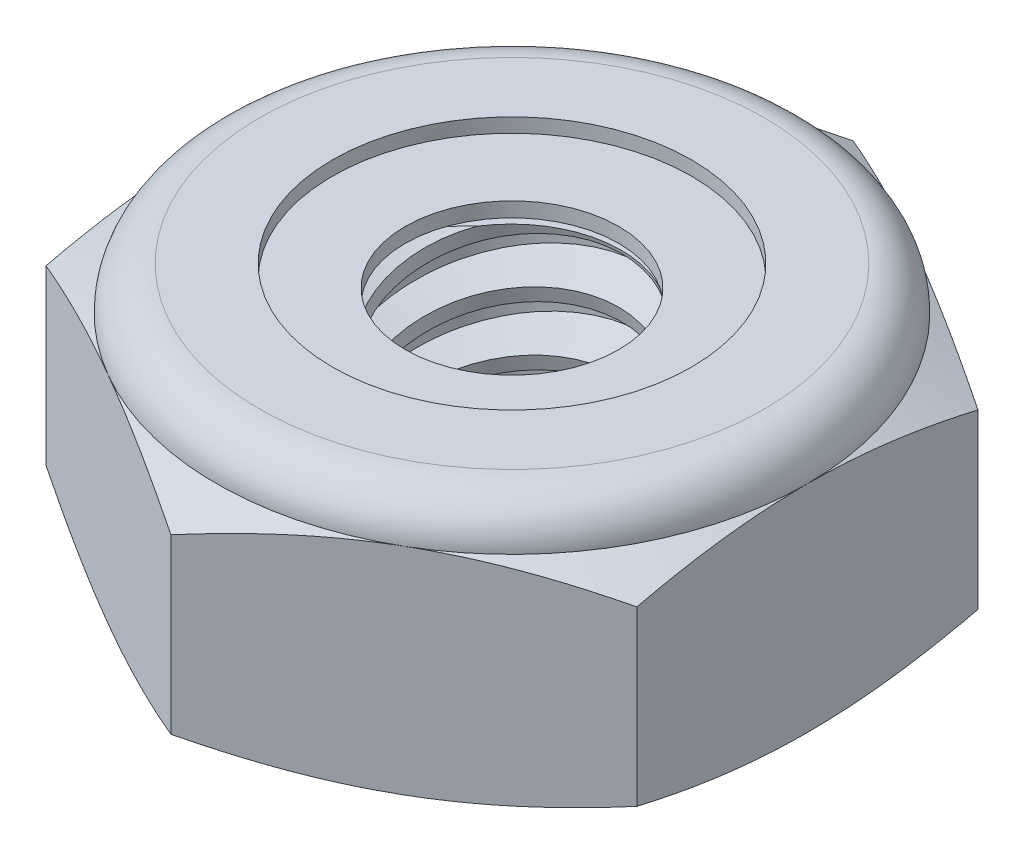
from build123d import *

# Parameters (mm, degrees)
EXTRUDE1_DEPTH      = 2.778125
SKETCH2_W           = 1.4224
SKETCH2_H           = 2.778125
LPATTERN1_COUNT     = 4
LPATTERN1_PITCH     = 0.635
LPATTERN1_COL_COUNT = 2
LPATTERN1_COL_PITCH = 0.635


with BuildPart() as part:
    # Sketch1 → Extrude1 (new body)
    with BuildSketch(Plane(origin=(0, 0, 0), x_dir=(1, 0, 0), z_dir=(0, 1, 0))):
        Polygon((0, 3.666174209), (-3.175, 1.833087105), (-3.175, -1.833087105), (0, -3.666174209), (3.175, -1.833087105), (3.175, 1.833087105), align=None)
    extrude(amount=EXTRUDE1_DEPTH)

    # Sketch4 → Cut-Revolve2 (revolve, cut)
    with BuildSketch(Plane(origin=(0, 0, 0), x_dir=(0, 0, -1), z_dir=(1, 0, 0))):
        Polygon((0, 2.778125), (1.4224, 2.778125), (1.147473684, 2.649924754), (1.147473684, 0.128200246), (1.4224, 0), (0, 0), align=None)
    revolve(axis=Axis((0, 2.778125, 0), (0, 1, 0)), mode=Mode.SUBTRACT)


with BuildPart() as body_2:
    # Sketch2 → Revolve1 (revolve)
    with BuildSketch(Plane(origin=(0, 0, 0), x_dir=(0, 0, -1), z_dir=(1, 0, 0))):
        with Locations((0.7112, 1.3890625)):
            Rectangle(SKETCH2_W, SKETCH2_H)
    revolve(axis=Axis((0, -1.4224, 0), (0, 1, 0)))

    # Sketch3 → Cut-Revolve1 (revolve, cut)
    with BuildSketch(Plane(origin=(0, 0, 0), x_dir=(0, 0, -1), z_dir=(1, 0, 0)), mode=Mode.PRIVATE) as cut_revolve1_sk:
        Polygon((1.439692084, 2.700656462), (1.560736676, 2.158376693), (1.182057853, 2.277171117), (1.147473684, 2.432108194), align=None)
    cut_revolve1 = revolve(cut_revolve1_sk.sketch.rotate(Axis((0, 2.778125, 0.152561988), (0, -0.9759815859905214, -0.21785303258716968)), 180), axis=Axis((0, 2.778125, 0.152561988), (0, -0.9759815859905214, -0.21785303258716968)), mode=Mode.SUBTRACT)

    # LPattern1: Cut-Revolve1 ×4
    with Locations(*[(0, -i * LPATTERN1_PITCH, 0) for i in range(1, LPATTERN1_COUNT)]):
        add(cut_revolve1, mode=Mode.SUBTRACT)

    # LPattern1 col: Cut-Revolve1 ×2
    with Locations(*[(0, i * LPATTERN1_COL_PITCH, 0) for i in range(1, LPATTERN1_COL_COUNT)]):
        add(cut_revolve1, mode=Mode.SUBTRACT)


with BuildPart() as part_1:
    add(part.part)

    # Combine1: cut body 2
    add(body_2.part, mode=Mode.SUBTRACT)

    # Sketch5 → Cut-Revolve3 (revolve, cut)
    with BuildSketch(Plane(origin=(0, 0, 0), x_dir=(0, 0, -1), z_dir=(1, 0, 0)), mode=Mode.PRIVATE) as cut_revolve3_sk:
        with BuildLine():
            Line((0, 0), (3.175, 0))
            Line((3.175, 0), (3.666174209, 0.229038295))
            Line((3.666174209, 0.229038295), (3.666174209, 2.086065871))
            Line((3.666174209, 2.086065871), (3.175, 2.315104167))
            ThreePointArc((3.175, 2.315104167), (3.039384338, 2.642509338), (2.711979167, 2.778125))
            Line((2.711979167, 2.778125), (2.711979167, 4.048125))
            Line((2.711979167, 4.048125), (4.936174209, 4.048125))
            Line((4.936174209, 4.048125), (4.936174209, -1.27))
            Line((4.936174209, -1.27), (0, -1.27))
            Line((0, -1.27), (0, 0))
        make_face()
    revolve(cut_revolve3_sk.sketch.rotate(Axis((0, 0, 0), (0, 1, 0)), 47.880307698), axis=Axis((0, 0, 0), (0, 1, 0)), mode=Mode.SUBTRACT)

    # Sketch6 → Cut-Revolve4 (revolve, cut)
    with BuildSketch(Plane(origin=(0, 0, 0), x_dir=(0, 0, -1), z_dir=(1, 0, 0))):
        with BuildLine():
            Line((0, 2.315104167), (3.0226, 2.315104167))
            ThreePointArc((3.0226, 2.315104167), (2.931621264, 2.534746264), (2.711979167, 2.625725))
            Line((2.711979167, 2.625725), (1.929726426, 2.625725))
            Line((1.929726426, 2.625725), (1.929726426, 4.048125))
            Line((1.929726426, 4.048125), (0, 4.048125))
            Line((0, 4.048125), (0, 2.315104167))
        make_face()
    revolve(axis=Axis((0, 4.048125, 0), (0, 1, 0)), mode=Mode.SUBTRACT)


with BuildPart() as body_2_2:
    # Sketch7 → Revolve2 (revolve)
    with BuildSketch(Plane(origin=(0, 0, 0), x_dir=(0, 0, -1), z_dir=(1, 0, 0))):
        with BuildLine():
            Line((1.147473684, 2.391304167), (2.933669688, 2.391304167))
            ThreePointArc((2.933669688, 2.391304167), (2.848159671, 2.505912964), (2.711979167, 2.549525))
            Line((2.711979167, 2.549525), (1.147473684, 2.549525))
            Line((1.147473684, 2.549525), (1.147473684, 2.391304167))
        make_face()
    revolve(axis=Axis((0, 2.391304167, 0), (0, 1, 0)))


solid = Compound([part_1.part, body_2_2.part])
